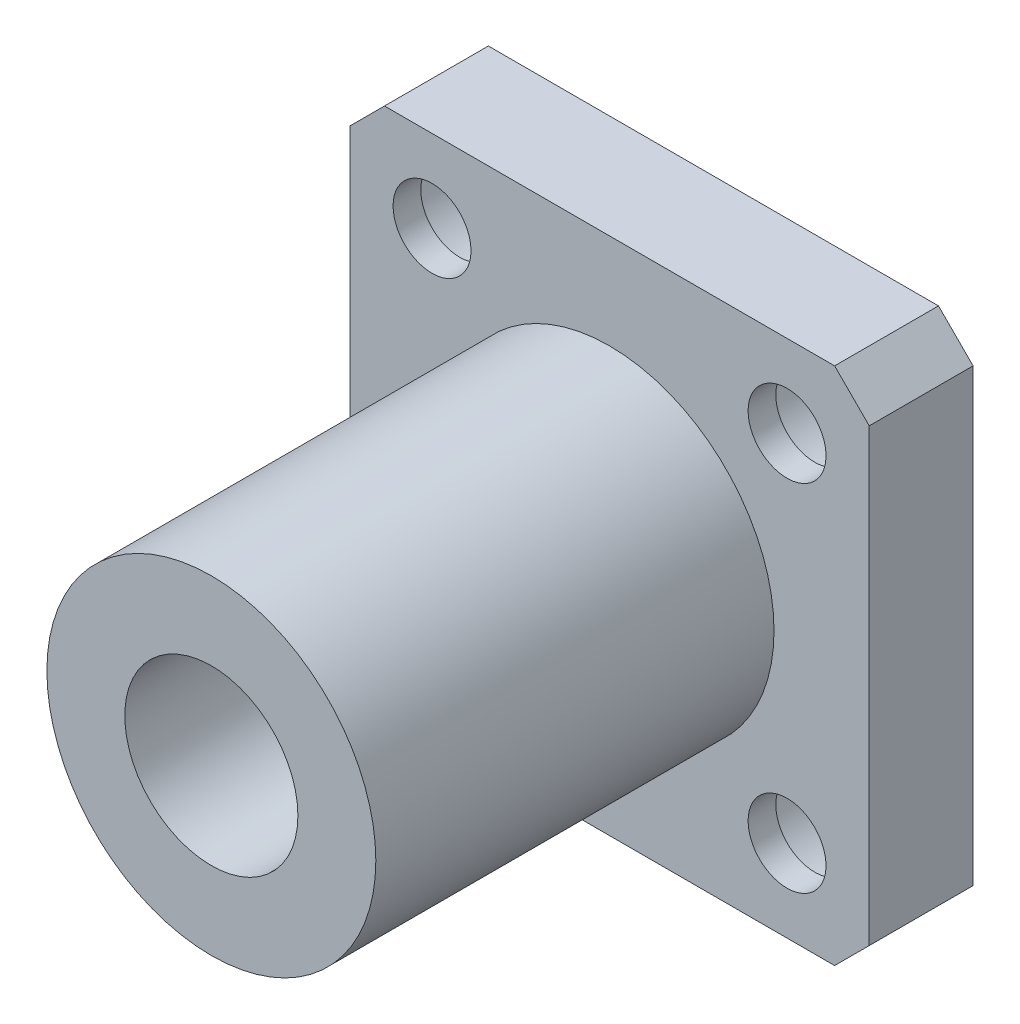
from build123d import *

# Parameters (mm, degrees)
SKETCH1_W                               = 30
SKETCH1_H                               = 30
BOSS_EXTRUDE1_DEPTH                     = 6
SKETCH2_R                               = 9.5
BOSS_EXTRUDE2_DEPTH                     = 23
SKETCH3_R                               = 5
CUT_EXTRUDE1_DEPTH                      = 52.39066063
CBORE_FOR_M5_HEX_HEAD_BOLT1_D           = 4.5
CBORE_FOR_M5_HEX_HEAD_BOLT1_CBORE_D     = 8
CBORE_FOR_M5_HEX_HEAD_BOLT1_CBORE_DEPTH = 4.4
CHAMFER1_SIZE                           = 2


with BuildPart() as part:
    # Sketch1 → Boss-Extrude1 (new body)
    with BuildSketch(Plane.XY):
        with Locations((15, 15)):
            Rectangle(SKETCH1_W, SKETCH1_H)
    extrude(amount=BOSS_EXTRUDE1_DEPTH)

    # Sketch2 → Boss-Extrude2 (add)
    with BuildSketch(Plane.XY.offset(6)):
        with Locations((15, 15)):
            Circle(SKETCH2_R)
    extrude(amount=BOSS_EXTRUDE2_DEPTH)

    # Sketch3 → Cut-Extrude1 (cut, through all)
    with BuildSketch(Plane.XY.offset(29)):
        with Locations((15, 15)):
            Circle(SKETCH3_R)
    extrude(amount=-CUT_EXTRUDE1_DEPTH, mode=Mode.SUBTRACT)

    # CBORE for M5 Hex Head Bolt1 (through all)
    with Locations(Plane(origin=(0, 0, 0), x_dir=(-1, 0, 0), z_dir=(0, 0, -1))):
        with Locations((-25.253048327, 25.253048327), (-4.746951673, 25.253048327), (-4.746951673, 4.746951673), (-25.253048327, 4.746951673)):
            CounterBoreHole(CBORE_FOR_M5_HEX_HEAD_BOLT1_D / 2, CBORE_FOR_M5_HEX_HEAD_BOLT1_CBORE_D / 2, CBORE_FOR_M5_HEX_HEAD_BOLT1_CBORE_DEPTH)

    # Chamfer1
    chamfer1_edges = [part.edges().sort_by_distance(p)[0] for p in [
        (0, 30, 3),
        (30, 30, 3),
        (30, 0, 3),
        (0, 0, 3),
    ]]
    chamfer(chamfer1_edges, length=CHAMFER1_SIZE)


solid = part.part
